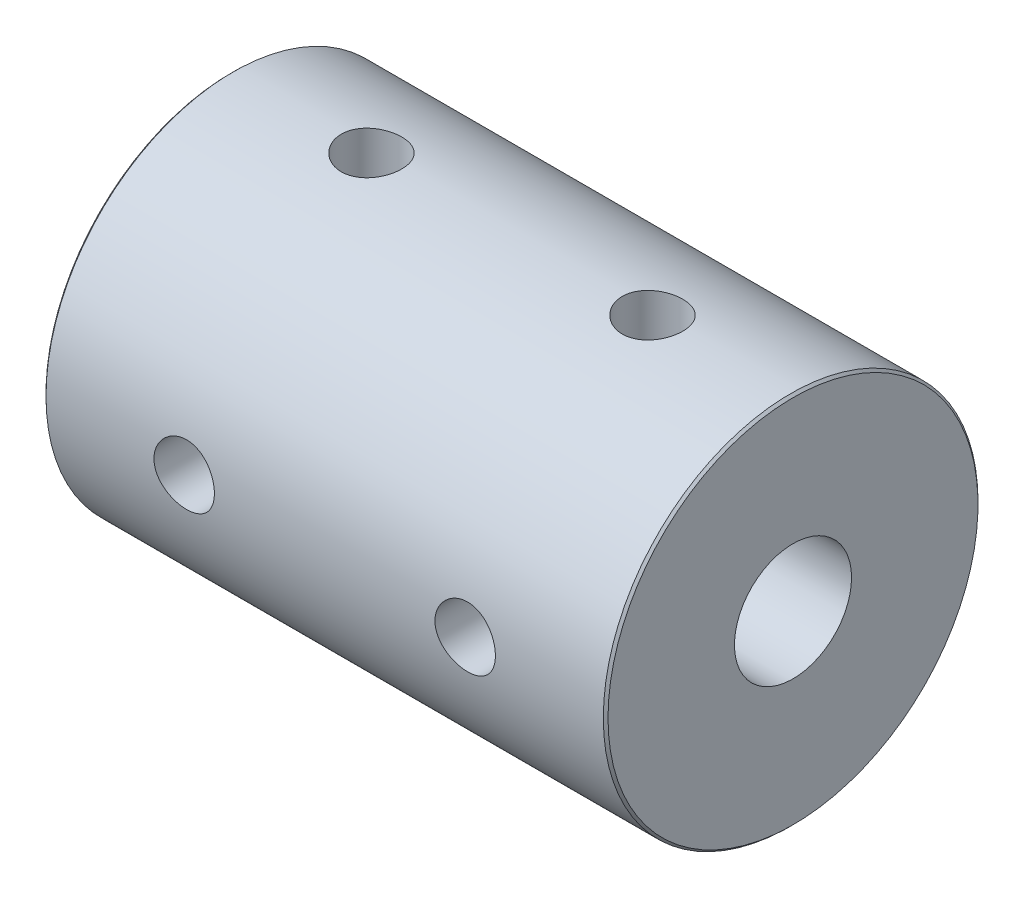
from build123d import *

# Parameters (mm, degrees)
SKETCH_1_R               = 8
EXTRUDE_1_DEPTH          = 24
SKETCH_2_R               = 2
CUT_EXTRUDE_1_DEPTH      = 12
SKETCH_3_R               = 2.5
CUT_EXTRUDE_2_DEPTH      = 12
CUT_EXTRUDE_3_REACH      = 28.533
CUT_EXTRUDE_3_END_RADIUS = 8
SKETCH_4_R               = 1.29
CUT_EXTRUDE_4_REACH      = 28.533
CUT_EXTRUDE_4_END_RADIUS = 8
SKETCH_5_R               = 1.29
CHAMFER_1_SIZE           = 0.1


with BuildPart() as part:
    # 草图1 → 凸台-拉伸1 (new body)
    with BuildSketch(Plane(origin=(0, 0, 0), x_dir=(0, 0, -1), z_dir=(1, 0, 0))):
        Circle(SKETCH_1_R)
    extrude(amount=EXTRUDE_1_DEPTH)

    # 草图2 → 切除-拉伸1 (cut)
    with BuildSketch(Plane.ZY):
        Circle(SKETCH_2_R)
    extrude(amount=-CUT_EXTRUDE_1_DEPTH, mode=Mode.SUBTRACT)

    # 草图3 → 切除-拉伸2 (cut)
    with BuildSketch(Plane(origin=(24, 0, 0), x_dir=(0, 0, -1), z_dir=(1, 0, 0))):
        Circle(SKETCH_3_R)
    extrude(amount=-CUT_EXTRUDE_2_DEPTH, mode=Mode.SUBTRACT)

    # 切除-拉伸3: up to this cylinder (the profile starts inside it)
    cut_extrude_3_end = Plane(origin=(12, 0, 0), z_dir=(-1, 0, 0)) * Cylinder(CUT_EXTRUDE_3_END_RADIUS, 86.066, mode=Mode.PRIVATE)
    # 草图4 → 切除-拉伸3 (cut, up to the surface)
    with BuildSketch(Plane(origin=(0, 0, 0), x_dir=(1, 0, 0), z_dir=(0, 1, 0)), mode=Mode.PRIVATE) as cut_extrude_3_sk1:
        with Locations(Location((6, 0, 0), (0, 0, 90))):
            Circle(SKETCH_4_R)
    cut_extrude_3_tool1 = extrude(cut_extrude_3_sk1.sketch, amount=CUT_EXTRUDE_3_REACH, mode=Mode.PRIVATE) & cut_extrude_3_end
    add(cut_extrude_3_tool1.solids().sort_by_distance((6, 0, 0))[0], mode=Mode.SUBTRACT)
    # 草图4 → 切除-拉伸3 (cut, up to the surface)
    with BuildSketch(Plane(origin=(0, 0, 0), x_dir=(1, 0, 0), z_dir=(0, 1, 0)), mode=Mode.PRIVATE) as cut_extrude_3_sk2:
        with Locations(Location((18, 0, 0), (0, 0, 90))):
            Circle(SKETCH_4_R)
    cut_extrude_3_tool2 = extrude(cut_extrude_3_sk2.sketch, amount=CUT_EXTRUDE_3_REACH, mode=Mode.PRIVATE) & cut_extrude_3_end
    add(cut_extrude_3_tool2.solids().sort_by_distance((18, 0, 0))[0], mode=Mode.SUBTRACT)

    # 切除-拉伸4: up to this cylinder (the profile starts inside it)
    cut_extrude_4_end = Plane(origin=(12, 0, 0), z_dir=(-1, 0, 0)) * Cylinder(CUT_EXTRUDE_4_END_RADIUS, 86.066, mode=Mode.PRIVATE)
    # 草图5 → 切除-拉伸4 (cut, up to the surface)
    with BuildSketch(Plane.XY, mode=Mode.PRIVATE) as cut_extrude_4_sk1:
        with Locations(Location((18, 0, 0), (0, 0, 180))):
            Circle(SKETCH_5_R)
    cut_extrude_4_tool1 = extrude(cut_extrude_4_sk1.sketch, amount=CUT_EXTRUDE_4_REACH, mode=Mode.PRIVATE) & cut_extrude_4_end
    add(cut_extrude_4_tool1.solids().sort_by_distance((18, 0, 0))[0], mode=Mode.SUBTRACT)
    # 草图5 → 切除-拉伸4 (cut, up to the surface)
    with BuildSketch(Plane.XY, mode=Mode.PRIVATE) as cut_extrude_4_sk2:
        with Locations(Location((6, 0, 0), (0, 0, 180))):
            Circle(SKETCH_5_R)
    cut_extrude_4_tool2 = extrude(cut_extrude_4_sk2.sketch, amount=CUT_EXTRUDE_4_REACH, mode=Mode.PRIVATE) & cut_extrude_4_end
    add(cut_extrude_4_tool2.solids().sort_by_distance((6, 0, 0))[0], mode=Mode.SUBTRACT)

    # 倒角1
    chamfer_1_edges = [part.edges().sort_by_distance(p)[0] for p in [
        (0, 0, 8),
        (24, 0, 8),
    ]]
    chamfer(chamfer_1_edges, length=CHAMFER_1_SIZE)


solid = part.part
